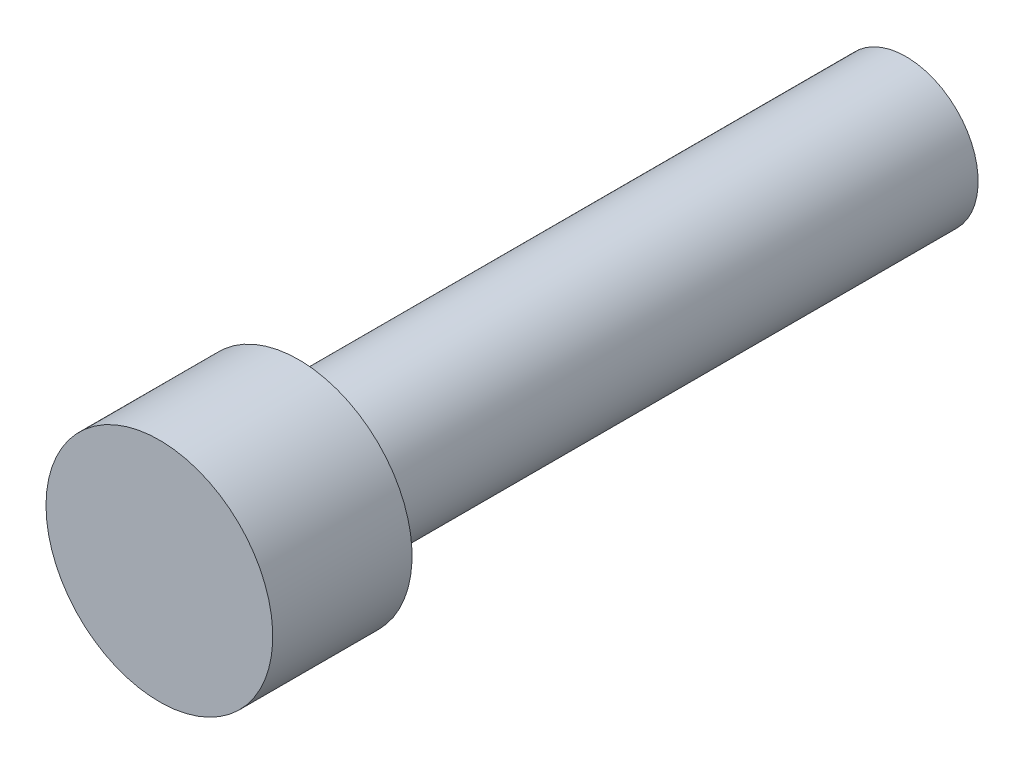
from build123d import *

# Parameters (mm, degrees)
SKETCH1_R         = 1.778
EXTRUDE1_DEPTH    = 11.7094
SKETCH3_OUTSIDE_W = 8.104
SKETCH3_OUTSIDE_H = 8.104
SKETCH3_OUTSIDE_R = 1.1303
EXTRUDE2_DEPTH    = 9.525


with BuildPart() as part:
    # Sketch1 → Extrude1 (new body)
    with BuildSketch(Plane.XY):
        with Locations(Location((0, 0, 0), (0, 0, 180))):
            Circle(SKETCH1_R)
    extrude(amount=EXTRUDE1_DEPTH)

    # Sketch3 outside → Extrude2 (cut)
    with BuildSketch(Plane(origin=(0, 0, 0), x_dir=(-1, 0, 0), z_dir=(0, 0, -1))):
        Rectangle(SKETCH3_OUTSIDE_W, SKETCH3_OUTSIDE_H)
        Circle(SKETCH3_OUTSIDE_R, mode=Mode.SUBTRACT)
    extrude(amount=-EXTRUDE2_DEPTH, mode=Mode.SUBTRACT)


solid = part.part
